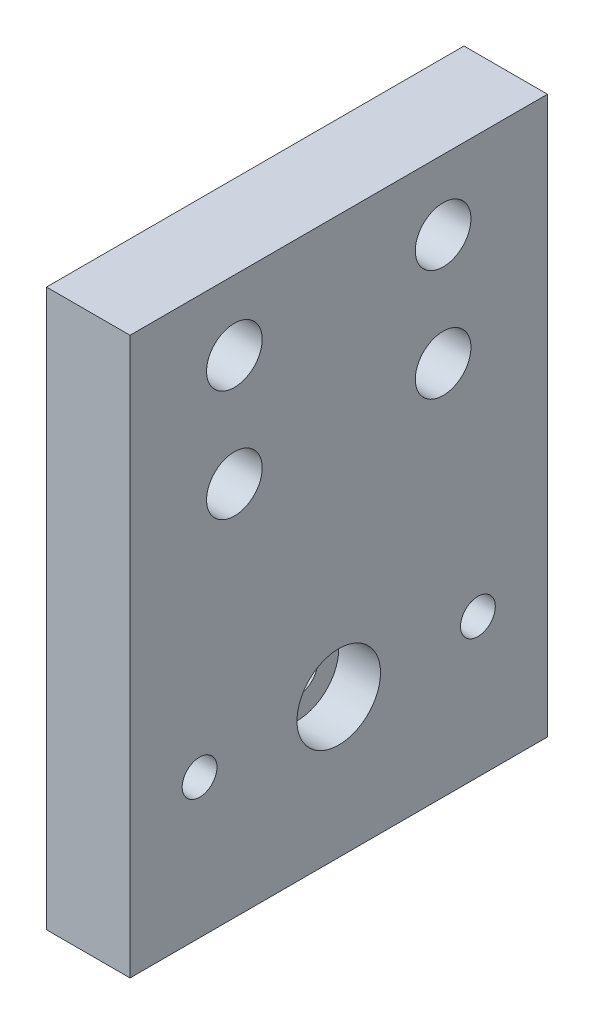
from build123d import *

# Parameters (mm, degrees)
SKETCH2_W           = 150
SKETCH2_H           = 200
BOSS_EXTRUDE1_DEPTH = 30
SKETCH3_R           = 10
CUT_EXTRUDE1_DEPTH  = 30
SKETCH4_R           = 15
CUT_EXTRUDE2_DEPTH  = 15
SKETCH6_R           = 7.5
CUT_EXTRUDE3_DEPTH  = 30
SKETCH7_R           = 4.5
CUT_EXTRUDE4_DEPTH  = 30
SKETCH9_R           = 6.25
CUT_EXTRUDE6_DEPTH  = 9


with BuildPart() as part:
    # Sketch2 → Boss-Extrude1 (new body)
    with BuildSketch(Plane(origin=(0, 0, 0), x_dir=(0, 0, -1), z_dir=(1, 0, 0))):
        with Locations((-75, 100)):
            Rectangle(SKETCH2_W, SKETCH2_H)
    extrude(amount=BOSS_EXTRUDE1_DEPTH)

    # Sketch3 → Cut-Extrude1 (cut)
    with BuildSketch(Plane(origin=(30, 0, 0), x_dir=(0, 0, -1), z_dir=(1, 0, 0))):
        with Locations((-112.5, 175)):
            Circle(SKETCH3_R)
        with Locations(Location((-37.5, 175, 0), (0, 0, 180))):
            Circle(SKETCH3_R)
        with Locations((-112.5, 135)):
            Circle(SKETCH3_R)
        with Locations(Location((-37.5, 135, 0), (0, 0, 180))):
            Circle(SKETCH3_R)
    extrude(amount=-CUT_EXTRUDE1_DEPTH, mode=Mode.SUBTRACT)

    # Sketch4 → Cut-Extrude2 (cut)
    with BuildSketch(Plane(origin=(30, 0, 0), x_dir=(0, 0, -1), z_dir=(1, 0, 0))):
        with Locations((-75, 50)):
            Circle(SKETCH4_R)
    extrude(amount=-CUT_EXTRUDE2_DEPTH, mode=Mode.SUBTRACT)

    # Sketch6 → Cut-Extrude3 (cut)
    with BuildSketch(Plane(origin=(30, 0, 0), x_dir=(0, 0, -1), z_dir=(1, 0, 0))):
        with Locations((-75, 50)):
            Circle(SKETCH6_R)
    extrude(amount=-CUT_EXTRUDE3_DEPTH, mode=Mode.SUBTRACT)

    # Sketch7 → Cut-Extrude4 (cut)
    with BuildSketch(Plane(origin=(30, 0, 0), x_dir=(0, 0, -1), z_dir=(1, 0, 0))):
        with Locations((-125, 50)):
            Circle(SKETCH7_R)
        with Locations((-25, 50)):
            Circle(SKETCH7_R)
    extrude(amount=-CUT_EXTRUDE4_DEPTH, mode=Mode.SUBTRACT)

    # Sketch9 → Cut-Extrude6 (cut)
    with BuildSketch(Plane(origin=(30, 0, 0), x_dir=(0, 0, -1), z_dir=(1, 0, 0))):
        with Locations((-125, 50)):
            Circle(SKETCH9_R)
        with Locations((-25, 50)):
            Circle(SKETCH9_R)
    extrude(amount=-CUT_EXTRUDE6_DEPTH, mode=Mode.SUBTRACT)


solid = part.part
